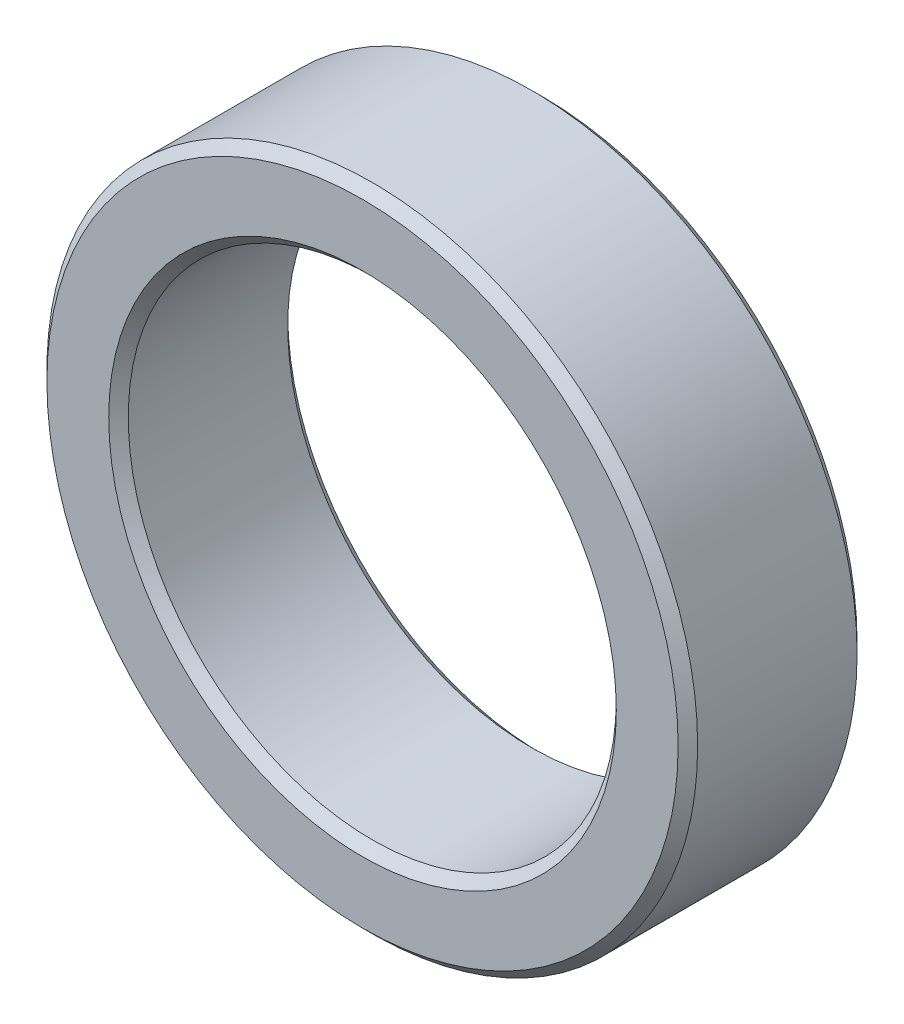
from build123d import *


with BuildPart() as part:
    # Esquisse1 → Révolution1 (revolve)
    with BuildSketch(Plane(origin=(0, 0, 0), x_dir=(0, 0, -1), z_dir=(1, 0, 0))):
        Polygon((-1.7, 10), (-2, 9.7), (-2, 7.8), (-1.7, 7.5), (3.2, 7.5), (3.5, 7.8), (3.5, 9.7), (3.2, 10), align=None)
    revolve(axis=Axis((0, 0, 10.3632), (0, 0, -1)))


solid = part.part
